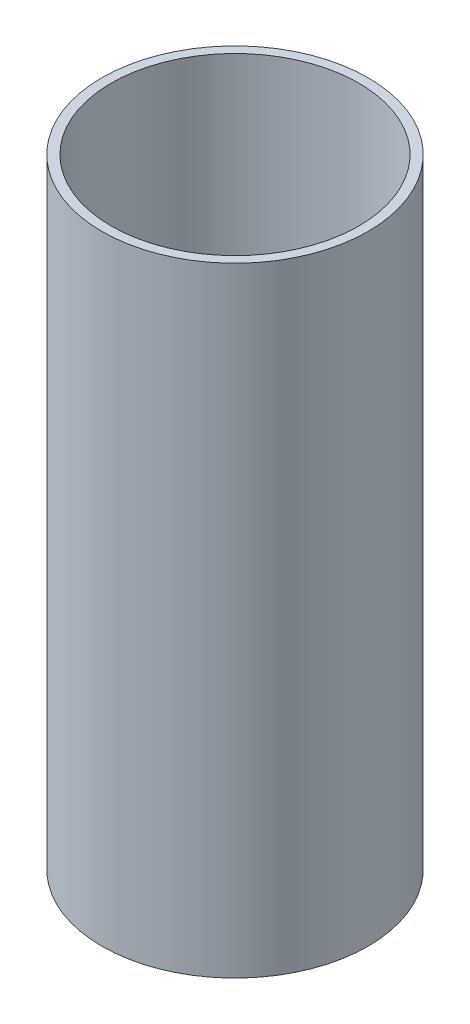
from build123d import *

# Parameters (mm, degrees)
SKETCH1_R           = 17.2
SKETCH1_R_2         = 16
BOSS_EXTRUDE1_DEPTH = 80


with BuildPart() as part:
    # Sketch1 → Boss-Extrude1 (new body)
    with BuildSketch(Plane(origin=(0, 0, 0), x_dir=(1, 0, 0), z_dir=(0, 1, 0))):
        with Locations(Location((0, 0, 0), (0, 0, 270))):
            Circle(SKETCH1_R)
        with Locations(Location((0, 0, 0), (0, 0, 270))):
            Circle(SKETCH1_R_2, mode=Mode.SUBTRACT)
    extrude(amount=BOSS_EXTRUDE1_DEPTH)


solid = part.part
